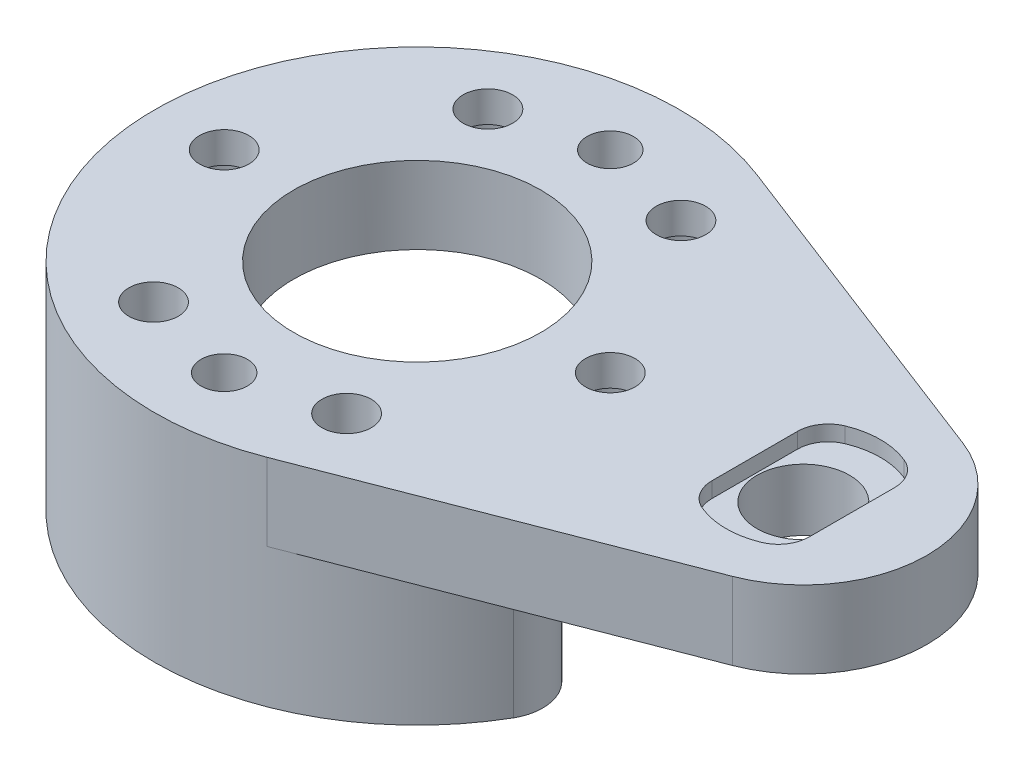
from build123d import *

# Parameters (mm, degrees)
EXTRUDE_1_DEPTH             = 5
EXTRUDE_2_DEPTH             = 9
CUT_EXTRUDE_1_DEPTH         = 1
HOLE_WIZARD_3_0_3_1_D       = 3
HOLE_WIZARD_3_0_3_1_DEPTH   = 3.5
HOLE_WIZARD_3_0_3_1_TIP     = 0.901290929
HOLE_WIZARD_3_0_3_2_D       = 3
HOLE_WIZARD_3_0_3_2_DEPTH   = 3.5
HOLE_WIZARD_3_0_3_2_TIP     = 0.901290929
HOLE_WIZARD_M31_D           = 3.2
HOLE_WIZARD_M31_CBORE_D     = 6.05
HOLE_WIZARD_M31_CBORE_DEPTH = 3
HOLE_WIZARD_16_0_16_1_D     = 16
HOLE_WIZARD_16_0_16_1_DEPTH = 14
HOLE_WIZARD_3_2_3_2_1_D     = 3.2
HOLE_WIZARD_6_0_6_1_D       = 6
HOLE_WIZARD_6_0_6_1_DEPTH   = 13
FILLET_1_R                  = 2
FILLET_2_R                  = 3


with BuildPart() as part:
    # Эскиз1 → Бобышка-Вытянуть1 (new body)
    with BuildSketch(Plane.XZ):
        with BuildLine():
            Line((6.12, -15.860189154), (27.88, -7.463618425))
            ThreePointArc((27.88, -7.463618425), (33, 0), (27.88, 7.463618425))
            Line((27.88, 7.463618425), (6.12, 15.860189154))
            ThreePointArc((6.12, 15.860189154), (-17, 0), (6.12, -15.860189154))
        make_face()
    extrude(amount=-EXTRUDE_1_DEPTH)

    # Эскиз2 → Бобышка-Вытянуть2 (add)
    with BuildSketch(Plane(origin=(0, 5, 0), x_dir=(-1, 0, 0), z_dir=(0, 1, 0))):
        with BuildLine():
            Line((12.124355653, 4), (-12.124355653, 4))
            ThreePointArc((-12.124355653, 4), (-14.722431864, 5.5), (-14.722431864, 8.5))
            ThreePointArc((-14.722431864, 8.5), (0, 17), (14.722431864, 8.5))
            ThreePointArc((14.722431864, 8.5), (14.722431864, 5.5), (12.124355653, 4))
        make_face()
    extrude(amount=EXTRUDE_2_DEPTH)

    # Эскиз3 → Вырез-Вытянуть1 (cut)
    with BuildSketch(Plane.XZ):
        with BuildLine():
            Line((21.85, 3.882975663), (21.85, -3.882975663))
            ThreePointArc((21.85, -3.882975663), (25, -5), (28.15, -3.882975663))
            Line((28.15, -3.882975663), (28.15, 3.882975663))
            ThreePointArc((28.15, 3.882975663), (25, 5), (21.85, 3.882975663))
        make_face()
    extrude(amount=-CUT_EXTRUDE_1_DEPTH, mode=Mode.SUBTRACT)

    # Диаметр отверстия Ø3.0 (3)1
    with Locations(Plane(origin=(0, 0, 0), x_dir=(-1, 0, 0), z_dir=(0, -1, 0))):
        with Locations((0, 12.5)):
            Hole(HOLE_WIZARD_3_0_3_1_D / 2, depth=HOLE_WIZARD_3_0_3_1_DEPTH)
            with Locations((0, 0, -(HOLE_WIZARD_3_0_3_1_DEPTH + HOLE_WIZARD_3_0_3_1_TIP / 2))):  # 118° drill point
                Cone(0, HOLE_WIZARD_3_0_3_1_D / 2, HOLE_WIZARD_3_0_3_1_TIP, mode=Mode.SUBTRACT)

    # Диаметр отверстия Ø3.0 (3)2
    with Locations(Plane(origin=(0, 0, 0), x_dir=(-1, 0, 0), z_dir=(0, -1, 0))):
        with Locations((0, -12.5)):
            Hole(HOLE_WIZARD_3_0_3_2_D / 2, depth=HOLE_WIZARD_3_0_3_2_DEPTH)
            with Locations((0, 0, -(HOLE_WIZARD_3_0_3_2_DEPTH + HOLE_WIZARD_3_0_3_2_TIP / 2))):  # 118° drill point
                Cone(0, HOLE_WIZARD_3_0_3_2_D / 2, HOLE_WIZARD_3_0_3_2_TIP, mode=Mode.SUBTRACT)

    # Цековка для винта с заклепочной головкой M31 (through all)
    with Locations(Plane(origin=(0, 5, 0), x_dir=(1, 0, 0), z_dir=(0, 1, 0))):
        with Locations((12.5, 0), (6.25, 10.825317547), (-6.25, 10.825317547), (-12.5, 0)):
            CounterBoreHole(HOLE_WIZARD_M31_D / 2, HOLE_WIZARD_M31_CBORE_D / 2, HOLE_WIZARD_M31_CBORE_DEPTH)

    # Диаметр отверстия Ø16.0 (16)1
    with Locations(Plane(origin=(0, 0, 0), x_dir=(-1, 0, 0), z_dir=(0, -1, 0))):
        with Locations((0, 0)):
            Hole(HOLE_WIZARD_16_0_16_1_D / 2, depth=HOLE_WIZARD_16_0_16_1_DEPTH)

    # Диаметр отверстия Ø3.2 (3.2)1 (through all)
    with Locations(Plane(origin=(0, 0, 0), x_dir=(-1, 0, 0), z_dir=(0, -1, 0))):
        with Locations((6.25, -10.825317547), (-6.25, -10.825317547)):
            Hole(HOLE_WIZARD_3_2_3_2_1_D / 2)

    # Диаметр отверстия Ø6.0 (6)1
    with Locations(Plane(origin=(0, 1, 0), x_dir=(-1, 0, 0), z_dir=(0, -1, 0))):
        with Locations((-25, 0)):
            Hole(HOLE_WIZARD_6_0_6_1_D / 2, depth=HOLE_WIZARD_6_0_6_1_DEPTH)

    # Скругление1
    fillet_1_edges = [part.edges().sort_by_distance(p)[0] for p in [
        (21.85, 0.5, 3.882975663),
        (28.15, 0.5, 3.882975663),
        (28.15, 0.5, -3.882975663),
        (21.85, 0.5, -3.882975663),
    ]]
    fillet(fillet_1_edges, radius=FILLET_1_R)

    # Скругление2
    fillet_2_edges = [part.edges().sort_by_distance(p)[0] for p in [
        (6.92820323, 9.5, 4),
        (-6.92820323, 9.5, 4),
    ]]
    fillet(fillet_2_edges, radius=FILLET_2_R)


with BuildPart() as body_2:
    # Зеркальное отражение1: mirrored copy
    add(part.part.mirror(Plane(origin=(0, 0, 0), x_dir=(0, 0, 1), z_dir=(0, -1, 0))))


solid = body_2.part
